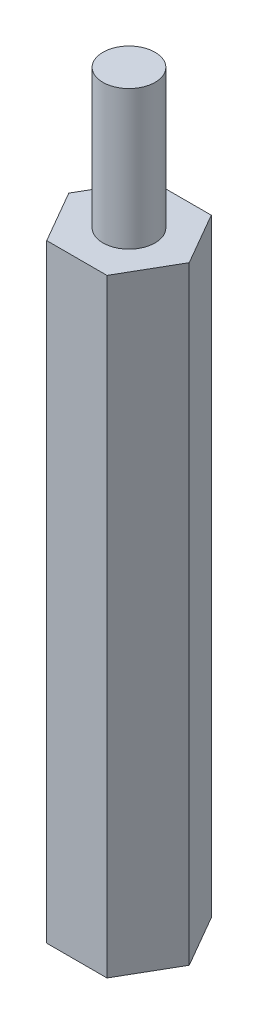
from build123d import *

# Parameters (mm, degrees)
BOSS_EXTRUDE1_DEPTH = 35
SKETCH2_R           = 1.5
BOSS_EXTRUDE2_DEPTH = 8


with BuildPart() as part:
    # Sketch1 → Boss-Extrude1 (new body)
    with BuildSketch(Plane(origin=(0, 0, 0), x_dir=(1, 0, 0), z_dir=(0, 1, 0))):
        Polygon((1.732050808, -3), (3.464101615, 0), (1.732050808, 3), (-1.732050808, 3), (-3.464101615, 0), (-1.732050808, -3), align=None)
    extrude(amount=BOSS_EXTRUDE1_DEPTH)

    # Sketch2 → Boss-Extrude2 (add)
    with BuildSketch(Plane(origin=(0, 35, 0), x_dir=(1, 0, 0), z_dir=(0, 1, 0))):
        with Locations(Location((0, 0, 0), (0, 0, 270))):
            Circle(SKETCH2_R)
    extrude(amount=BOSS_EXTRUDE2_DEPTH)


solid = part.part
